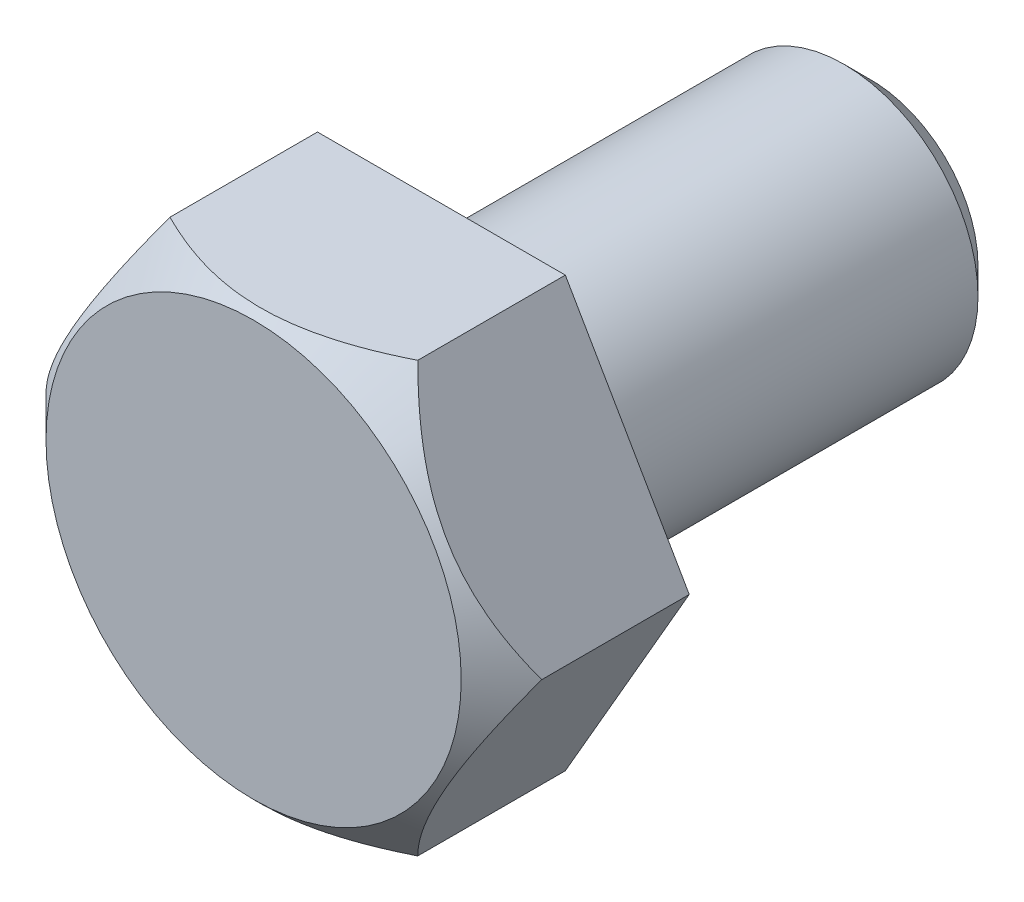
from build123d import *

# Parameters (mm, degrees)
BOSS_EXTRUDE1_DEPTH = 3.5
SKETCH3_R           = 3.25
BOSS_EXTRUDE3_DEPTH = 0.25
SKETCH2_R           = 2.5
BOSS_EXTRUDE2_DEPTH = 8
CHAMFER1_SIZE       = 0.5


with BuildPart() as part:
    # Sketch1 → Boss-Extrude1 (new body)
    with BuildSketch(Plane.XY):
        Polygon((4.618802154, 0), (2.309401077, 4), (-2.309401077, 4), (-4.618802154, 0), (-2.309401077, -4), (2.309401077, -4), align=None)
    extrude(amount=BOSS_EXTRUDE1_DEPTH)

    # Sketch3 → Boss-Extrude3 (add)
    with BuildSketch(Plane(origin=(0, 0, 0), x_dir=(-1, 0, 0), z_dir=(0, 0, -1))):
        Circle(SKETCH3_R)
    extrude(amount=BOSS_EXTRUDE3_DEPTH)

    # Sketch2 → Boss-Extrude2 (add)
    with BuildSketch(Plane(origin=(0, 0, 0), x_dir=(-1, 0, 0), z_dir=(0, 0, -1))):
        Circle(SKETCH2_R)
    extrude(amount=BOSS_EXTRUDE2_DEPTH)

    # Chamfer1
    chamfer1_edges = [part.edges().sort_by_distance(p)[0] for p in [
        (2.5, 0, -8),
    ]]
    chamfer(chamfer1_edges, length=CHAMFER1_SIZE)

    # Sketch4 → Cut-Revolve1 (revolve, cut)
    with BuildSketch(Plane(origin=(0, 0, 0), x_dir=(1, 0, 0), z_dir=(0, 1, 0))):
        Polygon((-4.868802154, -3.75), (-4.868802154, -2.5), (-3.618802154, -3.75), align=None)
    revolve(axis=Axis((0, 0, 3.5), (0, 0, -1)), mode=Mode.SUBTRACT)


solid = part.part
